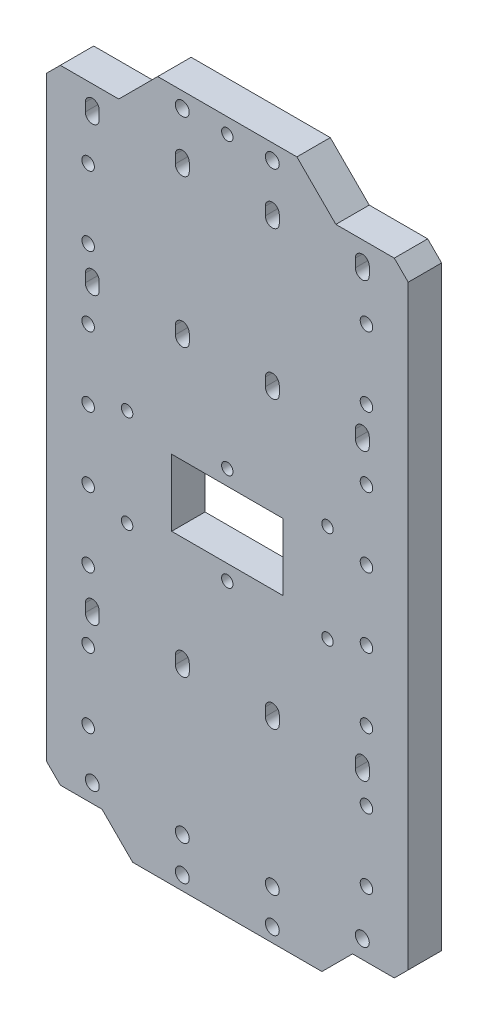
from build123d import *

# Parameters (mm, degrees)
MODEL_R             = 2.5
MODEL_R_2           = 2.05
MODEL_R_3           = 2.25
MODEL_W             = 40
MODEL_H             = 24
BOSS_EXTRUDE1_DEPTH = 12


with BuildPart() as part:
    # Model → Boss-Extrude1 (new body)
    with BuildSketch(Plane.XY):
        Polygon((125, 11), (130, 16), (130, 230), (125, 235), (104, 235), (90, 249), (40, 249), (26, 235), (5, 235), (0, 230), (0, 16), (5, 11), (20, 11), (31, 0), (99, 0), (110, 11), align=None)
        with Locations((16.49, 17.5)):
            Circle(MODEL_R, mode=Mode.SUBTRACT)
        with Locations((48.83, 17.5)):
            Circle(MODEL_R, mode=Mode.SUBTRACT)
        with Locations((81.17, 17.5)):
            Circle(MODEL_R, mode=Mode.SUBTRACT)
        with Locations((113.51, 17.5)):
            Circle(MODEL_R, mode=Mode.SUBTRACT)
        with Locations((29, 139.5)):
            Circle(MODEL_R_2, mode=Mode.SUBTRACT)
        with Locations((65, 139.5)):
            Circle(MODEL_R_2, mode=Mode.SUBTRACT)
        with Locations((101, 139.5)):
            Circle(MODEL_R_2, mode=Mode.SUBTRACT)
        with Locations((101, 104.5)):
            Circle(MODEL_R_2, mode=Mode.SUBTRACT)
        with Locations((65, 104.5)):
            Circle(MODEL_R_2, mode=Mode.SUBTRACT)
        with Locations((29, 104.5)):
            Circle(MODEL_R_2, mode=Mode.SUBTRACT)
        with Locations((65, 243.5)):
            Circle(MODEL_R_2, mode=Mode.SUBTRACT)
        with Locations((81.17, 5)):
            Circle(MODEL_R, mode=Mode.SUBTRACT)
        with Locations((48.83, 5)):
            Circle(MODEL_R, mode=Mode.SUBTRACT)
        with Locations((81.17, 243.5)):
            Circle(MODEL_R, mode=Mode.SUBTRACT)
        with Locations((48.83, 243.5)):
            Circle(MODEL_R, mode=Mode.SUBTRACT)
        with Locations((115, 34.5)):
            Circle(MODEL_R_3, mode=Mode.SUBTRACT)
        with Locations((115, 59.5)):
            Circle(MODEL_R_3, mode=Mode.SUBTRACT)
        with Locations((15, 34.5)):
            Circle(MODEL_R_3, mode=Mode.SUBTRACT)
        with Locations((15, 59.5)):
            Circle(MODEL_R_3, mode=Mode.SUBTRACT)
        with Locations((15, 84.5)):
            Circle(MODEL_R_3, mode=Mode.SUBTRACT)
        with Locations((15, 109.5)):
            Circle(MODEL_R_3, mode=Mode.SUBTRACT)
        with Locations((115, 84.5)):
            Circle(MODEL_R_3, mode=Mode.SUBTRACT)
        with Locations((115, 109.5)):
            Circle(MODEL_R_3, mode=Mode.SUBTRACT)
        with Locations((115, 134.5)):
            Circle(MODEL_R_3, mode=Mode.SUBTRACT)
        with Locations((15, 134.5)):
            Circle(MODEL_R_3, mode=Mode.SUBTRACT)
        with Locations((15, 159.5)):
            Circle(MODEL_R_3, mode=Mode.SUBTRACT)
        with Locations((115, 159.5)):
            Circle(MODEL_R_3, mode=Mode.SUBTRACT)
        with Locations((115, 184.5)):
            Circle(MODEL_R_3, mode=Mode.SUBTRACT)
        with Locations((15, 184.5)):
            Circle(MODEL_R_3, mode=Mode.SUBTRACT)
        with Locations((15, 209.5)):
            Circle(MODEL_R_3, mode=Mode.SUBTRACT)
        with Locations((115, 209.5)):
            Circle(MODEL_R_3, mode=Mode.SUBTRACT)
        with Locations((65, 122)):
            Rectangle(MODEL_W, MODEL_H, mode=Mode.SUBTRACT)
        with BuildLine():
            Line((13.99, 174.82), (13.99, 171.82))
            ThreePointArc((13.99, 171.82), (16.49, 169.32), (18.99, 171.82))
            Line((18.99, 171.82), (18.99, 174.82))
            ThreePointArc((18.99, 174.82), (16.49, 177.32), (13.99, 174.82))
        make_face(mode=Mode.SUBTRACT)
        with BuildLine():
            Line((46.33, 174.82), (46.33, 171.82))
            ThreePointArc((46.33, 171.82), (48.83, 169.32), (51.33, 171.82))
            Line((51.33, 171.82), (51.33, 174.82))
            ThreePointArc((51.33, 174.82), (48.83, 177.32), (46.33, 174.82))
        make_face(mode=Mode.SUBTRACT)
        with BuildLine():
            Line((78.67, 174.82), (78.67, 171.82))
            ThreePointArc((78.67, 171.82), (81.17, 169.32), (83.67, 171.82))
            Line((83.67, 171.82), (83.67, 174.82))
            ThreePointArc((83.67, 174.82), (81.17, 177.32), (78.67, 174.82))
        make_face(mode=Mode.SUBTRACT)
        with BuildLine():
            Line((111.01, 174.82), (111.01, 171.82))
            ThreePointArc((111.01, 171.82), (113.51, 169.32), (116.01, 171.82))
            Line((116.01, 171.82), (116.01, 174.82))
            ThreePointArc((116.01, 174.82), (113.51, 177.32), (111.01, 174.82))
        make_face(mode=Mode.SUBTRACT)
        with BuildLine():
            Line((13.99, 228), (13.99, 225))
            ThreePointArc((13.99, 225), (16.49, 222.5), (18.99, 225))
            Line((18.99, 225), (18.99, 228))
            ThreePointArc((18.99, 228), (16.49, 230.5), (13.99, 228))
        make_face(mode=Mode.SUBTRACT)
        with BuildLine():
            Line((51.33, 225), (51.33, 228))
            ThreePointArc((51.33, 228), (48.83, 230.5), (46.33, 228))
            Line((46.33, 228), (46.33, 225))
            ThreePointArc((46.33, 225), (48.83, 222.5), (51.33, 225))
        make_face(mode=Mode.SUBTRACT)
        with BuildLine():
            Line((83.67, 225), (83.67, 228))
            ThreePointArc((83.67, 228), (81.17, 230.5), (78.67, 228))
            Line((78.67, 228), (78.67, 225))
            ThreePointArc((78.67, 225), (81.17, 222.5), (83.67, 225))
        make_face(mode=Mode.SUBTRACT)
        with BuildLine():
            Line((116.01, 225), (116.01, 228))
            ThreePointArc((116.01, 228), (113.51, 230.5), (111.01, 228))
            Line((111.01, 228), (111.01, 225))
            ThreePointArc((111.01, 225), (113.51, 222.5), (116.01, 225))
        make_face(mode=Mode.SUBTRACT)
        with BuildLine():
            Line((18.99, 69.18), (18.99, 72.18))
            ThreePointArc((18.99, 72.18), (16.49, 74.68), (13.99, 72.18))
            Line((13.99, 72.18), (13.99, 69.18))
            ThreePointArc((13.99, 69.18), (16.49, 66.68), (18.99, 69.18))
        make_face(mode=Mode.SUBTRACT)
        with BuildLine():
            Line((51.33, 69.18), (51.33, 72.18))
            ThreePointArc((51.33, 72.18), (48.83, 74.68), (46.33, 72.18))
            Line((46.33, 72.18), (46.33, 69.18))
            ThreePointArc((46.33, 69.18), (48.83, 66.68), (51.33, 69.18))
        make_face(mode=Mode.SUBTRACT)
        with BuildLine():
            Line((83.67, 69.18), (83.67, 72.18))
            ThreePointArc((83.67, 72.18), (81.17, 74.68), (78.67, 72.18))
            Line((78.67, 72.18), (78.67, 69.18))
            ThreePointArc((78.67, 69.18), (81.17, 66.68), (83.67, 69.18))
        make_face(mode=Mode.SUBTRACT)
        with BuildLine():
            Line((116.01, 69.18), (116.01, 72.18))
            ThreePointArc((116.01, 72.18), (113.51, 74.68), (111.01, 72.18))
            Line((111.01, 72.18), (111.01, 69.18))
            ThreePointArc((111.01, 69.18), (113.51, 66.68), (116.01, 69.18))
        make_face(mode=Mode.SUBTRACT)
    extrude(amount=BOSS_EXTRUDE1_DEPTH)


solid = part.part
